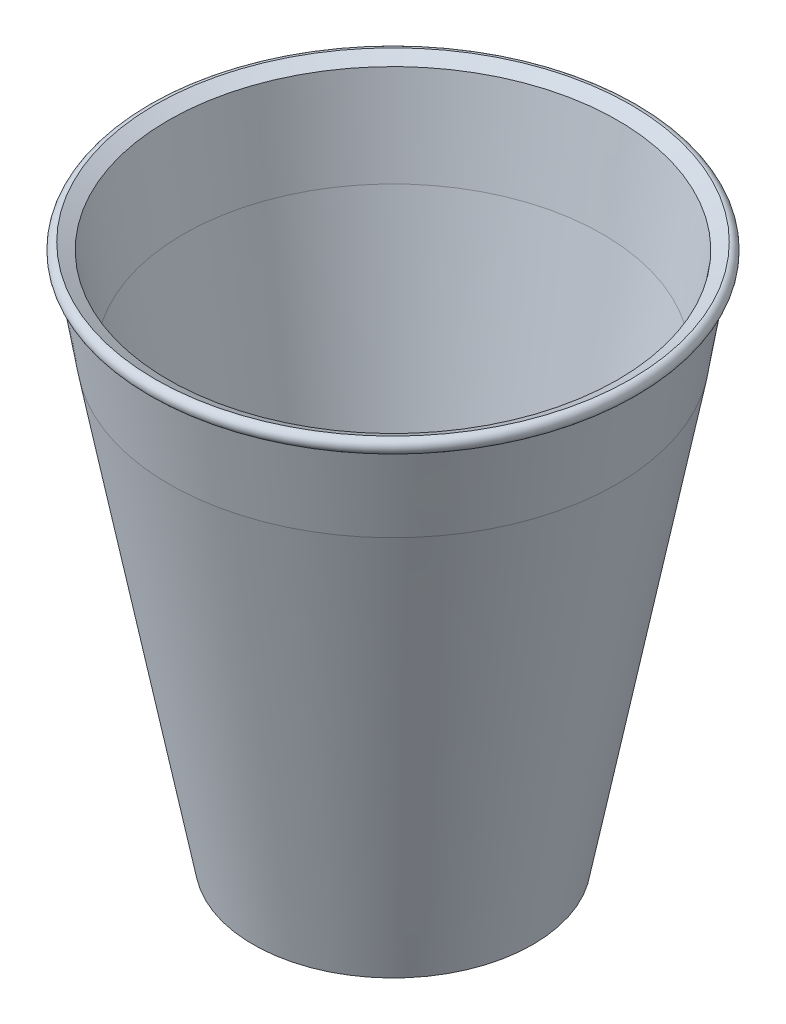
from build123d import *


with BuildPart() as part:
    # Sketch1 → Revolve1 (revolve)
    with BuildSketch(Plane.XY):
        with BuildLine():
            Line((-32.130708731, -1), (-34, 0))
            ThreePointArc((-34, 0), (-35, -1), (-34, -2))
            Line((-34, -2), (-32, -14))
            Line((-32, -14), (-20, -77))
            Line((-20, -77), (-12.6, -77))
            Line((-12.6, -77), (-12.6, -75.97))
            Line((-12.6, -75.97), (0, -75.97))
            Line((0, -75.97), (0, -74))
            Line((0, -74), (-18.535470636, -74))
            Line((-18.535470636, -74), (-29.964042064, -14))
            Line((-29.964042064, -14), (-32.130708731, -1))
        make_face()
    revolve(axis=Axis((0, 0, 0), (0, -1, 0)))


solid = part.part
